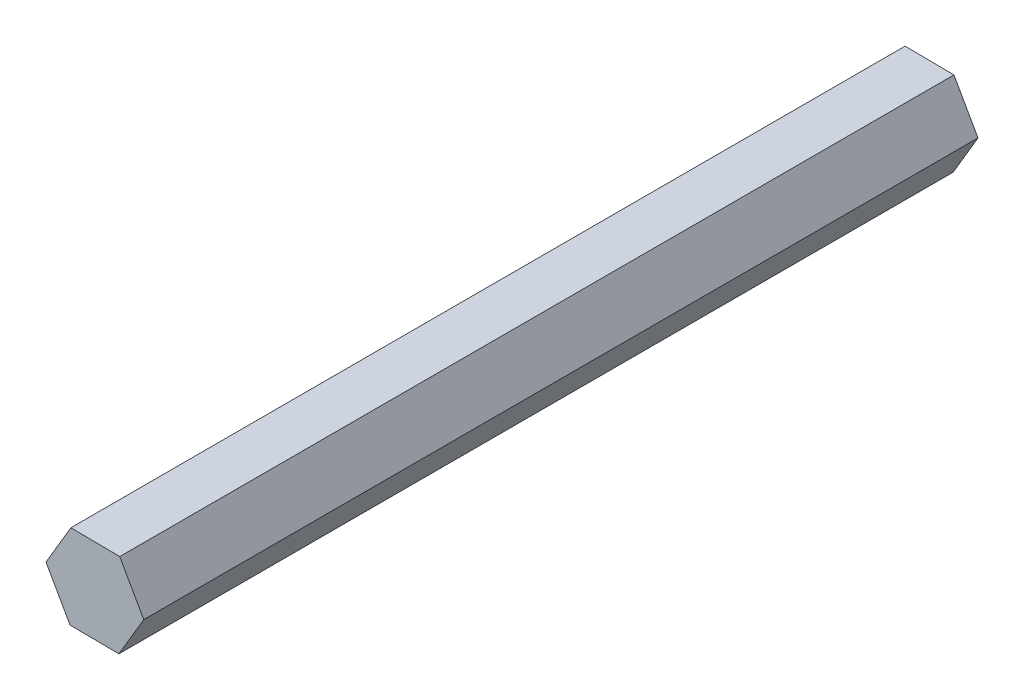
from build123d import *

# Parameters (mm, degrees)
BOSS_EXTRUDE1_DEPTH = 46.1


with BuildPart() as part:
    # Sketch1 → Boss-Extrude1 (new body)
    with BuildSketch(Plane.XY):
        Polygon((-2.352966639, -1.366238693), (-0.979381565, 0.960575447), (-2.307669183, 3.313542086), (-5.009541876, 3.339694584), (-6.38312695, 1.012880443), (-5.054839331, -1.340086195), align=None)
    extrude(amount=BOSS_EXTRUDE1_DEPTH)


solid = part.part
